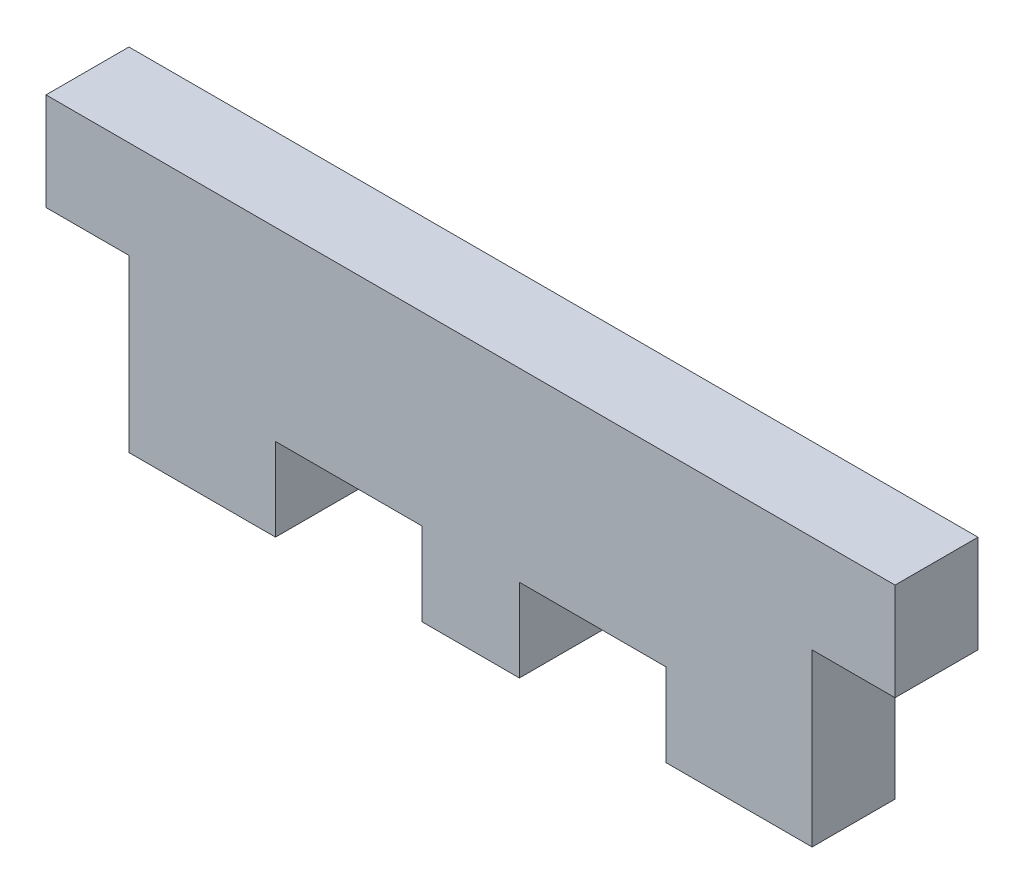
from build123d import *

# Parameters (mm, degrees)
BOSS_EXTRUDE1_DEPTH = 17


with BuildPart() as part:
    # Sketch1 → Boss-Extrude1 (new body)
    with BuildSketch(Plane.XY):
        Polygon((-70.039233477, 27.5), (-87.039233477, 27.5), (-87.039233477, 7.5), (-70.039233477, 7.5), (-70.039233477, -7.5), (-70, -27.5), (-40, -27.5), (-40, -10.5), (-10, -10.5), (-10, -27.5), (10, -27.5), (10, -10.5), (40, -10.5), (40, -27.5), (70, -27.5), (70, -7.5), (70, 7.5), (87, 7.5), (87, 27.5), (70, 27.5), align=None)
    extrude(amount=BOSS_EXTRUDE1_DEPTH)


solid = part.part
